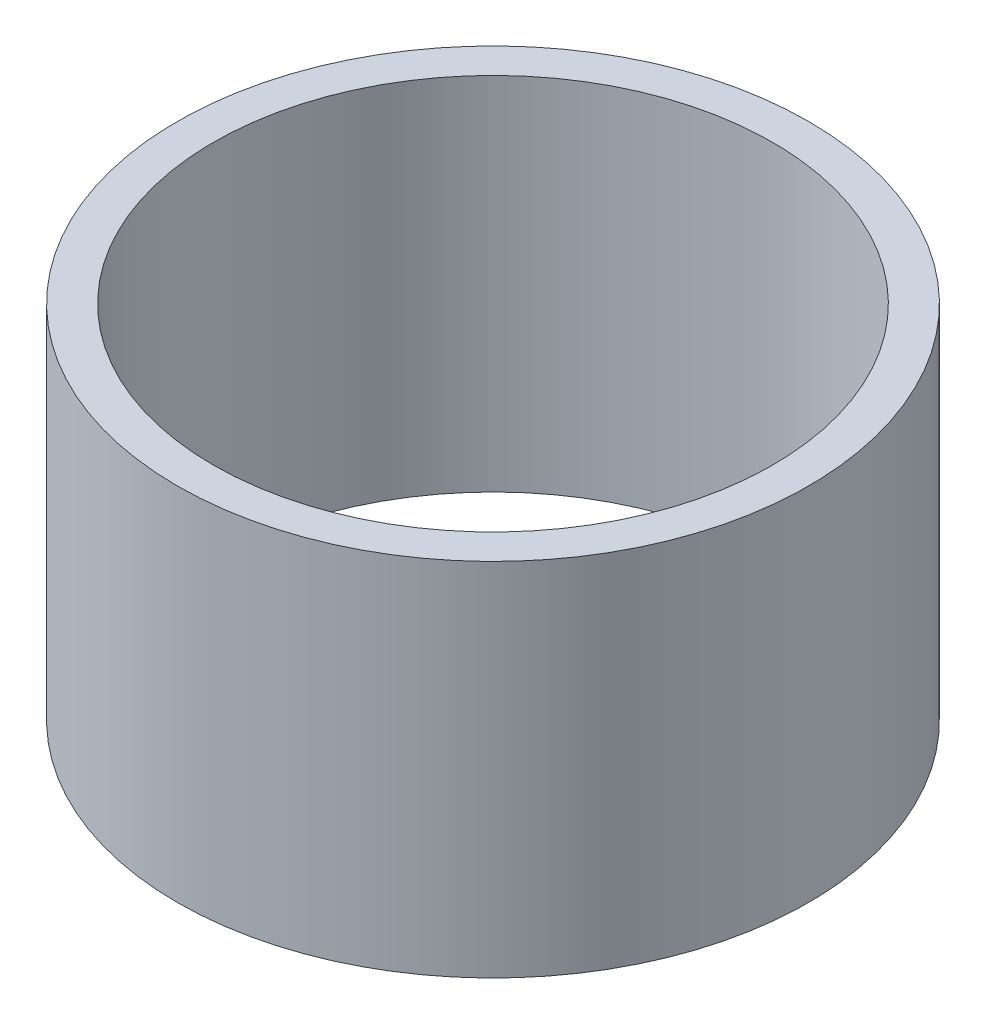
from build123d import *

# Parameters (mm, degrees)
IZIM2_R                     = 3.5
IZIM2_R_2                   = 3.1
Y_KSEKLIK_EKSTR_ZYON1_DEPTH = 4


with BuildPart() as part:
    # Çizim2 → Yükseklik-Ekstrüzyon1 (new body)
    with BuildSketch(Plane(origin=(0, 0, 0), x_dir=(1, 0, 0), z_dir=(0, 1, 0))):
        with Locations(Location((0, 0, 0), (0, 0, 270))):
            Circle(IZIM2_R)
        with Locations(Location((0, 0, 0), (0, 0, 270))):
            Circle(IZIM2_R_2, mode=Mode.SUBTRACT)
    extrude(amount=Y_KSEKLIK_EKSTR_ZYON1_DEPTH)


solid = part.part
